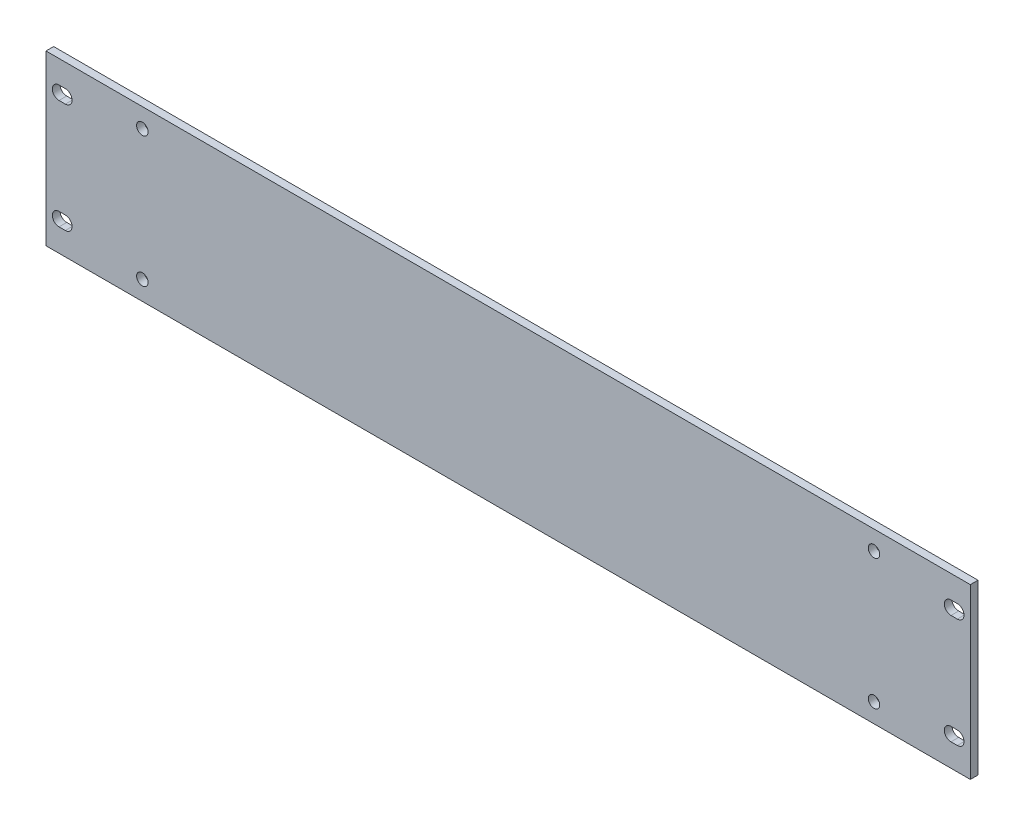
from build123d import *

# Parameters (mm, degrees)
SKETCH_1_W          = 482.6
SKETCH_1_H          = 88.1
EXTRUDE_1_DEPTH     = 4
CUT_EXTRUDE_1_DEPTH = 491.591856842
SKETCH_3_R          = 3
CUT_EXTRUDE_2_DEPTH = 491.591856842


with BuildPart() as part:
    # Эскиз1 → Бобышка-Вытянуть1 (new body)
    with BuildSketch(Plane.XY):
        with Locations((241.3, 44.05)):
            Rectangle(SKETCH_1_W, SKETCH_1_H)
    extrude(amount=EXTRUDE_1_DEPTH)

    # Эскиз2 → Вырез-Вытянуть1 (cut, through all)
    with BuildSketch(Plane.XY.offset(4)):
        with BuildLine():
            Line((6.8, 76.12), (10.1, 76.12))
            ThreePointArc((10.1, 76.12), (13.6, 72.62), (10.1, 69.12))
            Line((10.1, 69.12), (6.8, 69.12))
            ThreePointArc((6.8, 69.12), (3.3, 72.62), (6.8, 76.12))
        make_face()
        with BuildLine():
            Line((472.5, 76.12), (475.8, 76.12))
            ThreePointArc((475.8, 76.12), (479.3, 72.62), (475.8, 69.12))
            Line((475.8, 69.12), (472.5, 69.12))
            ThreePointArc((472.5, 69.12), (469, 72.62), (472.5, 76.12))
        make_face()
        with BuildLine():
            Line((472.5, 18.97), (475.8, 18.97))
            ThreePointArc((475.8, 18.97), (479.3, 15.47), (475.8, 11.97))
            Line((475.8, 11.97), (472.5, 11.97))
            ThreePointArc((472.5, 11.97), (469, 15.47), (472.5, 18.97))
        make_face()
        with BuildLine():
            Line((6.8, 18.97), (10.1, 18.97))
            ThreePointArc((10.1, 18.97), (13.6, 15.47), (10.1, 11.97))
            Line((10.1, 11.97), (6.8, 11.97))
            ThreePointArc((6.8, 11.97), (3.3, 15.47), (6.8, 18.97))
        make_face()
    extrude(amount=-CUT_EXTRUDE_1_DEPTH, mode=Mode.SUBTRACT)

    # Эскиз3 → Вырез-Вытянуть2 (cut, through all)
    with BuildSketch(Plane.XY.offset(4)):
        with Locations((50.3, 78.1)):
            Circle(SKETCH_3_R)
        with Locations((432.3, 78.1)):
            Circle(SKETCH_3_R)
        with Locations((432.3, 10)):
            Circle(SKETCH_3_R)
        with Locations((50.3, 10)):
            Circle(SKETCH_3_R)
    extrude(amount=-CUT_EXTRUDE_2_DEPTH, mode=Mode.SUBTRACT)


solid = part.part
